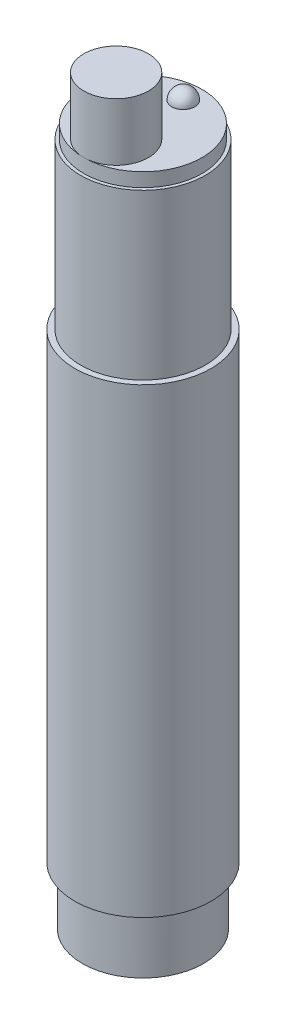
from build123d import *

# Parameters (mm, degrees)
CROQUIS1_R              = 5.9
SALIENTE_EXTRUIR1_DEPTH = 40
CROQUIS2_R              = 5.4
SALIENTE_EXTRUIR2_DEPTH = 14.25
CROQUIS3_R              = 5.125
SALIENTE_EXTRUIR3_DEPTH = 1.2
CROQUIS4_R              = 2.8
SALIENTE_EXTRUIR4_DEPTH = 5
CROQUIS6_R              = 5.25
SALIENTE_EXTRUIR6_DEPTH = 5


with BuildPart() as part:
    # Croquis1 → Saliente-Extruir1 (new body)
    with BuildSketch(Plane(origin=(0, 0, 0), x_dir=(1, 0, 0), z_dir=(0, 1, 0))):
        with Locations(Location((0, 0, 0), (0, 0, 270))):
            Circle(CROQUIS1_R)
    extrude(amount=SALIENTE_EXTRUIR1_DEPTH)

    # Croquis2 → Saliente-Extruir2 (add)
    with BuildSketch(Plane(origin=(0, 40, 0), x_dir=(1, 0, 0), z_dir=(0, 1, 0))):
        with Locations(Location((0, 0, 0), (0, 0, 90))):
            Circle(CROQUIS2_R)
    extrude(amount=SALIENTE_EXTRUIR2_DEPTH)

    # Croquis3 → Saliente-Extruir3 (add)
    with BuildSketch(Plane(origin=(0, 54.25, 0), x_dir=(1, 0, 0), z_dir=(0, 1, 0))):
        with Locations(Location((0, 0, 0), (0, 0, 270))):
            Circle(CROQUIS3_R)
    extrude(amount=SALIENTE_EXTRUIR3_DEPTH)

    # Croquis4 → Saliente-Extruir4 (add)
    with BuildSketch(Plane(origin=(0, 55.45, 0), x_dir=(1, 0, 0), z_dir=(0, 1, 0))):
        with Locations(Location((0, -2.325, 0), (0, 0, 270))):
            Circle(CROQUIS4_R)
    extrude(amount=SALIENTE_EXTRUIR4_DEPTH)

    # Croquis6 → Saliente-Extruir6 (add)
    with BuildSketch(Plane.XZ):
        with Locations(Location((0, 0, 0), (0, 0, 90))):
            Circle(CROQUIS6_R)
    extrude(amount=SALIENTE_EXTRUIR6_DEPTH)

    # Croquis7 → Revolución1 (revolve)
    with BuildSketch(Plane(origin=(0, 55.45, 0), x_dir=(1, 0, 0), z_dir=(0, 1, 0))):
        with BuildLine():
            Line((0, 2.5), (0, 4.5))
            ThreePointArc((0, 4.5), (-1, 3.5), (0, 2.5))
        make_face()
    revolve(axis=Axis((0, 55.45, -2.5), (0, 0, -1)))


solid = part.part
